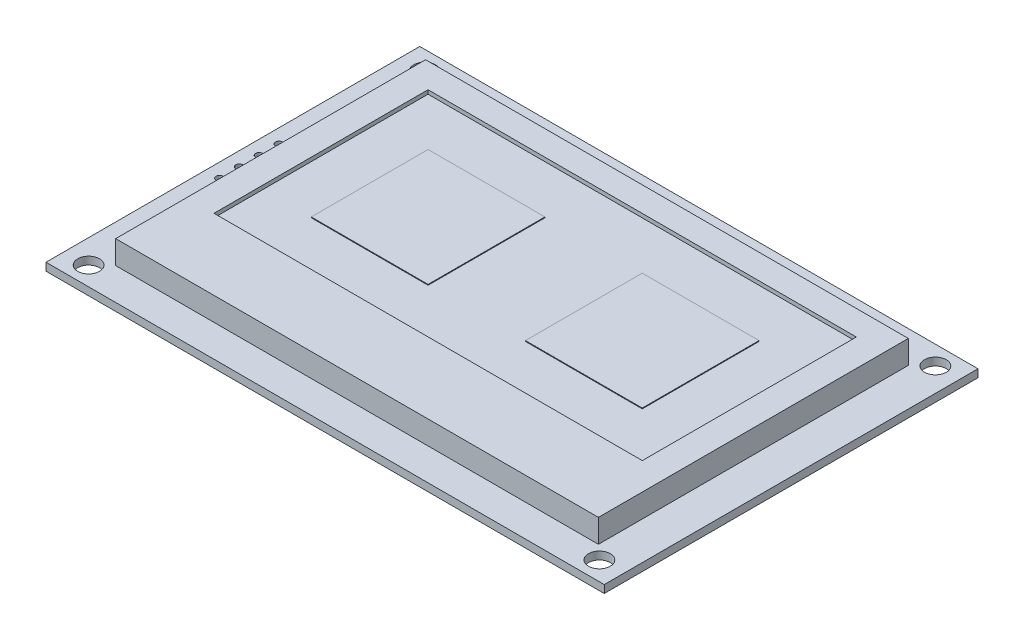
from build123d import *

# Parameters (mm, degrees)
SKETCH1_W           = 71.7
SKETCH1_H           = 48
BOSS_EXTRUDE1_DEPTH = 1
SKETCH2_R           = 1.4
CUT_EXTRUDE1_DEPTH  = 44.153476106
BOSS_EXTRUDE2_START = -1
SKETCH3_W           = 62
SKETCH3_H           = 39.8
BOSS_EXTRUDE2_DEPTH = 4
SKETCH4_W           = 55.01
SKETCH4_H           = 27.49
CUT_EXTRUDE2_DEPTH  = 0.5
SKETCH5_R           = 0.45
CUT_EXTRUDE3_DEPTH  = 44.246069186
LPATTERN1_COUNT     = 4
LPATTERN1_PITCH     = 2.54
SKETCH6_R           = 0.45
CUT_EXTRUDE4_DEPTH  = 44.246069186
LPATTERN2_COUNT     = 4
LPATTERN2_PITCH     = 2.54
SKETCH7_W           = 15
SKETCH7_H           = 15
BOSS_EXTRUDE3_DEPTH = 0.1


with BuildPart() as part:
    # Sketch1 → Boss-Extrude1 (new body)
    with BuildSketch(Plane(origin=(0, 0, 0), x_dir=(1, 0, 0), z_dir=(0, 1, 0))):
        Rectangle(SKETCH1_W, SKETCH1_H)
    extrude(amount=BOSS_EXTRUDE1_DEPTH)

    # Sketch2 → Cut-Extrude1 (cut, through all)
    with BuildSketch(Plane(origin=(0, 1, 0), x_dir=(1, 0, 0), z_dir=(0, 1, 0))):
        with Locations(Location((-32.8, 21.575, 0), (0, 0, 270))):
            Circle(SKETCH2_R)
        with Locations(Location((32.8, 21.575, 0), (0, 0, 270))):
            Circle(SKETCH2_R)
        with Locations(Location((-32.8, -21.575, 0), (0, 0, 270))):
            Circle(SKETCH2_R)
        with Locations(Location((32.8, -21.575, 0), (0, 0, 270))):
            Circle(SKETCH2_R)
    extrude(amount=-CUT_EXTRUDE1_DEPTH, mode=Mode.SUBTRACT)

    # Sketch3 → Boss-Extrude2 (add)
    with BuildSketch(Plane(origin=(0, 1, 0), x_dir=(1, 0, 0), z_dir=(0, 1, 0)).offset(BOSS_EXTRUDE2_START)):
        Rectangle(SKETCH3_W, SKETCH3_H)
    extrude(amount=BOSS_EXTRUDE2_DEPTH)

    # Sketch4 → Cut-Extrude2 (cut)
    with BuildSketch(Plane(origin=(0, 4, 0), x_dir=(1, 0, 0), z_dir=(0, 1, 0))):
        with Locations((0, 2.976)):
            Rectangle(SKETCH4_W, SKETCH4_H)
    extrude(amount=-CUT_EXTRUDE2_DEPTH, mode=Mode.SUBTRACT)

    # Sketch5 → Cut-Extrude3 (cut, through all)
    with BuildSketch(Plane(origin=(0, 1, 0), x_dir=(1, 0, 0), z_dir=(0, 1, 0))):
        with Locations(Location((-4.66, 21.55, 0), (0, 0, 270))):
            Circle(SKETCH5_R)
    cut_extrude3 = extrude(amount=-CUT_EXTRUDE3_DEPTH, mode=Mode.SUBTRACT)

    # LPattern1: Cut-Extrude3 ×4
    with Locations(*[(i * LPATTERN1_PITCH, 0, 0) for i in range(1, LPATTERN1_COUNT)]):
        add(cut_extrude3, mode=Mode.SUBTRACT)

    # Sketch6 → Cut-Extrude4 (cut, through all)
    with BuildSketch(Plane(origin=(0, 1, 0), x_dir=(1, 0, 0), z_dir=(0, 1, 0))):
        with Locations(Location((-34.05, 4.11, 0), (0, 0, 270))):
            Circle(SKETCH6_R)
    cut_extrude4 = extrude(amount=-CUT_EXTRUDE4_DEPTH, mode=Mode.SUBTRACT)

    # LPattern2: Cut-Extrude4 ×4
    with Locations(*[(0, 0, i * LPATTERN2_PITCH) for i in range(1, LPATTERN2_COUNT)]):
        add(cut_extrude4, mode=Mode.SUBTRACT)

    # Sketch7 → Boss-Extrude3 (add)
    with BuildSketch(Plane(origin=(0, 3.5, 0), x_dir=(1, 0, 0), z_dir=(0, 1, 0))):
        with Locations((-13.7525, 2.976)):
            Rectangle(SKETCH7_W, SKETCH7_H)
    boss_extrude3 = extrude(amount=BOSS_EXTRUDE3_DEPTH)

    # Mirror1: Boss-Extrude3 across plane
    add(boss_extrude3.mirror(Plane(origin=(0, 0, 0), x_dir=(0, 0, 1), z_dir=(1, 0, 0))))


solid = part.part
